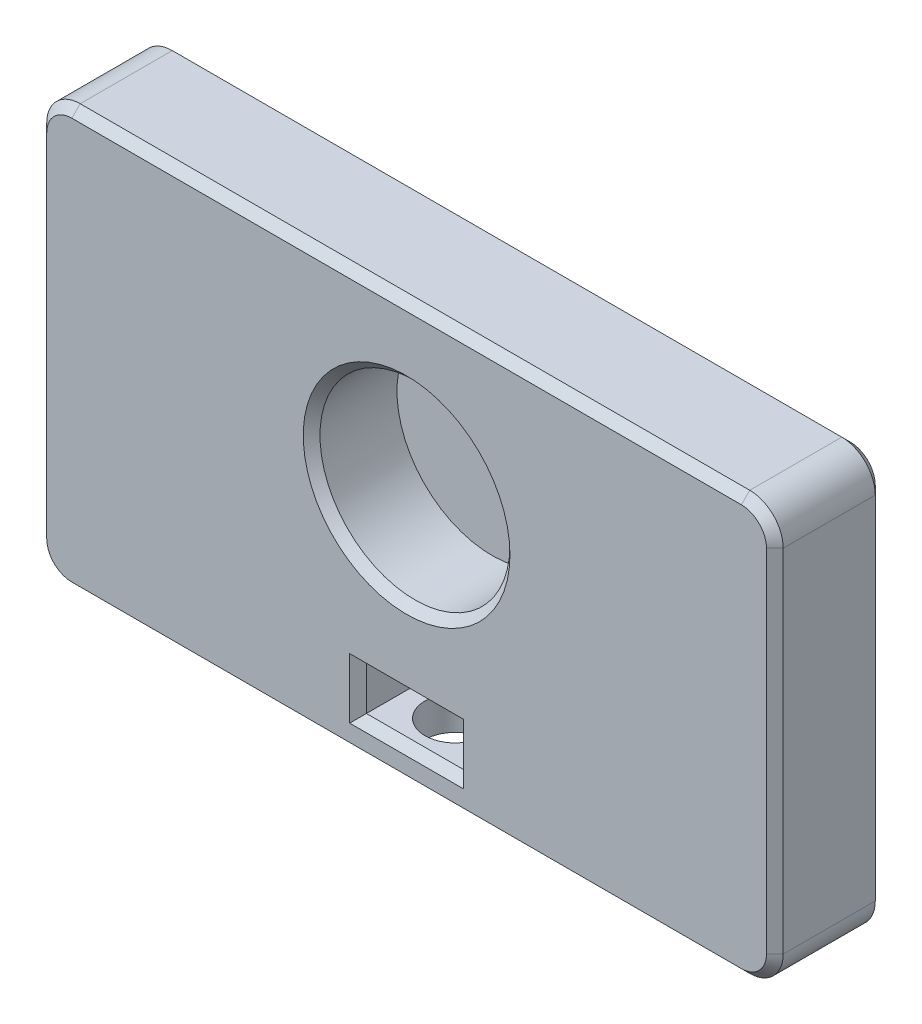
from build123d import *

# Parameters (mm, degrees)
SKIZZE1_W                            = 44
SKIZZE1_H                            = 25
AUFSATZ_LINEAR_AUSTRAGEN1_DEPTH      = 6.5
SKIZZE2_R                            = 5.675
SCHNITT_LINEAR_AUSTRAGEN1_DEPTH      = 5.1
VERRUNDUNG1_R                        = 2
SKIZZE8_W                            = 5.8
SKIZZE8_H                            = 2.6
SCHNITT_LINEAR_AUSTRAGEN5_DEPTH      = 4.5
SCHNITT_LINEAR_AUSTRAGEN6_DEPTH      = 2.6
SCHNITT_LINEAR_AUSTRAGEN7_DEPTH      = 31.698697041
SCHNITT_LINEAR_AUSTRAGEN7_DEPTH_BACK = 4.1
FASE1_SIZE                           = 0.5


with BuildPart() as part:
    # Skizze1 → Aufsatz-Linear austragen1 (new body)
    with BuildSketch(Plane.XY):
        with Locations((0, -2.5)):
            Rectangle(SKIZZE1_W, SKIZZE1_H)
    extrude(amount=AUFSATZ_LINEAR_AUSTRAGEN1_DEPTH)

    # Skizze2 → Schnitt-Linear austragen1 (cut)
    with BuildSketch(Plane.XY.offset(6.5)):
        Circle(SKIZZE2_R)
    extrude(amount=-SCHNITT_LINEAR_AUSTRAGEN1_DEPTH, mode=Mode.SUBTRACT)

    # Verrundung1
    verrundung1_edges = [part.edges().sort_by_distance(p)[0] for p in [
        (-22, 10, 3.25),
        (22, 10, 3.25),
        (22, -15, 3.25),
        (-22, -15, 3.25),
    ]]
    fillet(verrundung1_edges, radius=VERRUNDUNG1_R)

    # Skizze8 → Schnitt-Linear austragen5 (cut)
    with BuildSketch(Plane.XY.offset(6.5)):
        with Locations((0, -11.7)):
            Rectangle(SKIZZE8_W, SKIZZE8_H)
    extrude(amount=-SCHNITT_LINEAR_AUSTRAGEN5_DEPTH, mode=Mode.SUBTRACT)

    # Skizze9 → Schnitt-Linear austragen6 (cut)
    with BuildSketch(Plane.XZ.offset(10.4)):
        with BuildLine():
            Line((-0.820441954, 2), (-2.775, 2))
            Line((-2.775, 2), (0, 0.397853003))
            Line((0, 0.397853003), (2.775, 2))
            Line((2.775, 2), (0.820441954, 2))
            ThreePointArc((0.820441954, 2), (0, 1.802146997), (-0.820441954, 2))
        make_face()
        with BuildLine():
            ThreePointArc((1.8, 3.602146997), (-0.938936761, 5.137854573), (-0.820441954, 2))
            Line((-0.820441954, 2), (0.820441954, 2))
            ThreePointArc((0.820441954, 2), (1.535707576, 2.663210236), (1.8, 3.602146997))
        make_face()
        with BuildLine():
            Line((0.820441954, 2), (-0.820441954, 2))
            ThreePointArc((-0.820441954, 2), (0, 1.802146997), (0.820441954, 2))
        make_face()
    extrude(amount=SCHNITT_LINEAR_AUSTRAGEN6_DEPTH, mode=Mode.SUBTRACT)

    # Skizze9<3> → Schnitt-Linear austragen7 (cut, two sides: drawn at the far end of the back side and taken through both)
    with BuildSketch(Plane.XZ.offset(10.4).offset(-SCHNITT_LINEAR_AUSTRAGEN7_DEPTH_BACK)):
        with BuildLine():
            ThreePointArc((1.8, 3.602146997), (-0.938936761, 5.137854573), (-0.820441954, 2))
            Line((-0.820441954, 2), (0.820441954, 2))
            ThreePointArc((0.820441954, 2), (1.535707576, 2.663210236), (1.8, 3.602146997))
        make_face()
        with BuildLine():
            Line((0.820441954, 2), (-0.820441954, 2))
            ThreePointArc((-0.820441954, 2), (0, 1.802146997), (0.820441954, 2))
        make_face()
    extrude(amount=SCHNITT_LINEAR_AUSTRAGEN7_DEPTH + SCHNITT_LINEAR_AUSTRAGEN7_DEPTH_BACK, mode=Mode.SUBTRACT)

    # Fase1
    fase1_edges = [part.edges().sort_by_distance(p)[0] for p in [
        (-5.675, 0, 6.5),
        (0, 10, 0),
        (0, 10, 6.5),
        (-22, -2.5, 0),
        (22, -2.5, 0),
        (0, -15, 0),
        (-21.414213562, -14.414213562, 0),
        (-21.414213562, 9.414213562, 0),
        (21.414213562, -14.414213562, 0),
        (21.414213562, 9.414213562, 0),
        (22, -2.5, 6.5),
        (-22, -2.5, 6.5),
        (0, -15, 6.5),
        (-21.414213562, -14.414213562, 6.5),
        (-21.414213562, 9.414213562, 6.5),
        (21.414213562, -14.414213562, 6.5),
        (21.414213562, 9.414213562, 6.5),
        (2.9, -11.7, 6.5),
        (0, -10.4, 6.5),
        (-2.9, -11.7, 6.5),
        (0, -13, 6.5),
    ]]
    chamfer(fase1_edges, length=FASE1_SIZE)


solid = part.part
